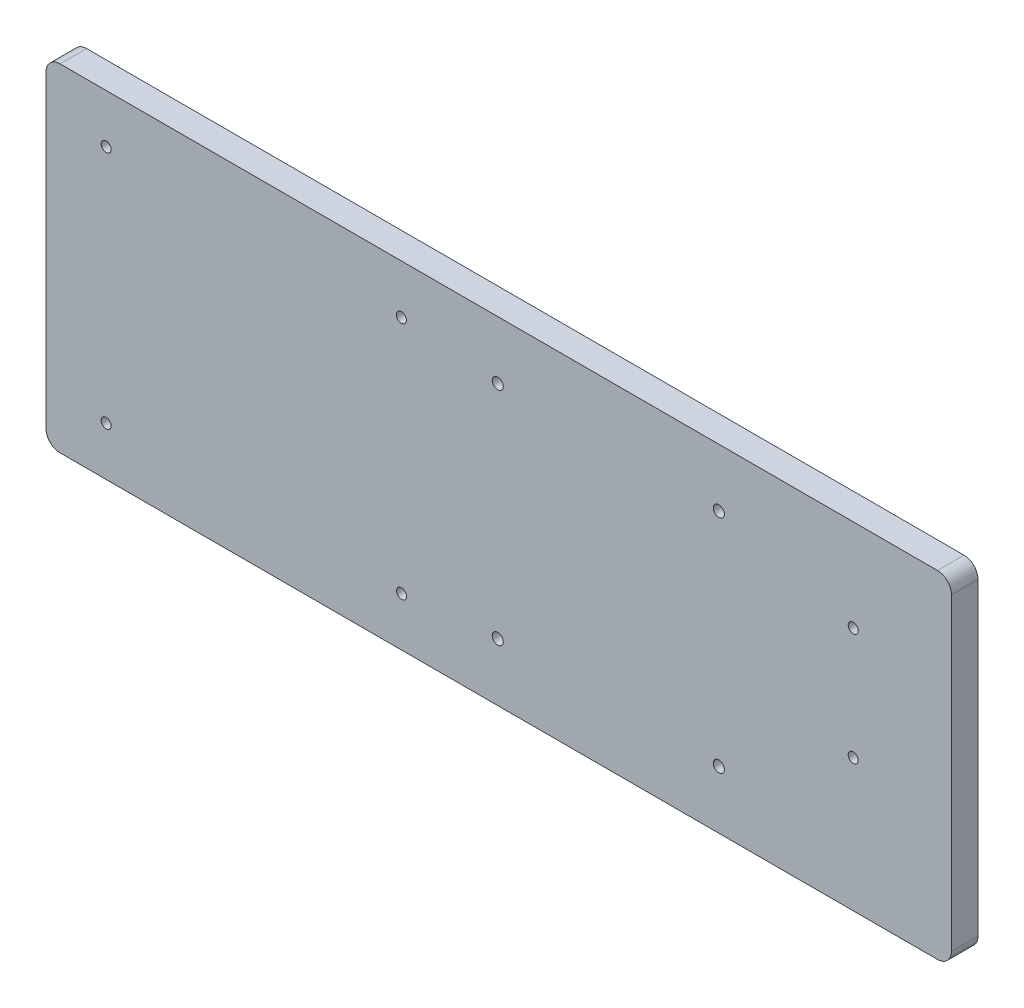
from build123d import *

# Parameters (mm, degrees)
BOSS_EXTRUDE1_DEPTH   = 6
F_4_40_TAPPED_HOLE1_D = 2.2606
M3X0_5_TAPPED_HOLE1_D = 2.5


with BuildPart() as part:
    # Sketch1 → Boss-Extrude1 (new body)
    with BuildSketch(Plane.XY):
        with BuildLine():
            Line((3.175, 0), (201.6304, 0))
            ThreePointArc((201.6304, 0), (203.87546403, 0.92993597), (204.8054, 3.175))
            Line((204.8054, 3.175), (204.8054, 73.025))
            ThreePointArc((204.8054, 73.025), (203.87546403, 75.27006403), (201.6304, 76.2))
            Line((201.6304, 76.2), (3.175, 76.2))
            ThreePointArc((3.175, 76.2), (0.92993597, 75.27006403), (0, 73.025))
            Line((0, 73.025), (0, 3.175))
            ThreePointArc((0, 3.175), (0.92993597, 0.92993597), (3.175, 0))
        make_face()
    extrude(amount=BOSS_EXTRUDE1_DEPTH)

    # #4-40 Tapped Hole1 (through all)
    with Locations(Plane.XY.offset(6)):
        with Locations((13.6017, 65.1891), (13.6017, 11.0363), (80.4291, 11.0617), (80.3783, 65.1383), (182.5804, 30), (182.5804, 55.4)):
            Hole(F_4_40_TAPPED_HOLE1_D / 2)

    # M3x0.5 Tapped Hole1 (through all)
    with Locations(Plane.XY.offset(6)):
        with Locations((102.1804, 63.1), (152.1804, 63.1), (152.1804, 13.1), (102.1804, 13.1)):
            Hole(M3X0_5_TAPPED_HOLE1_D / 2)


solid = part.part
